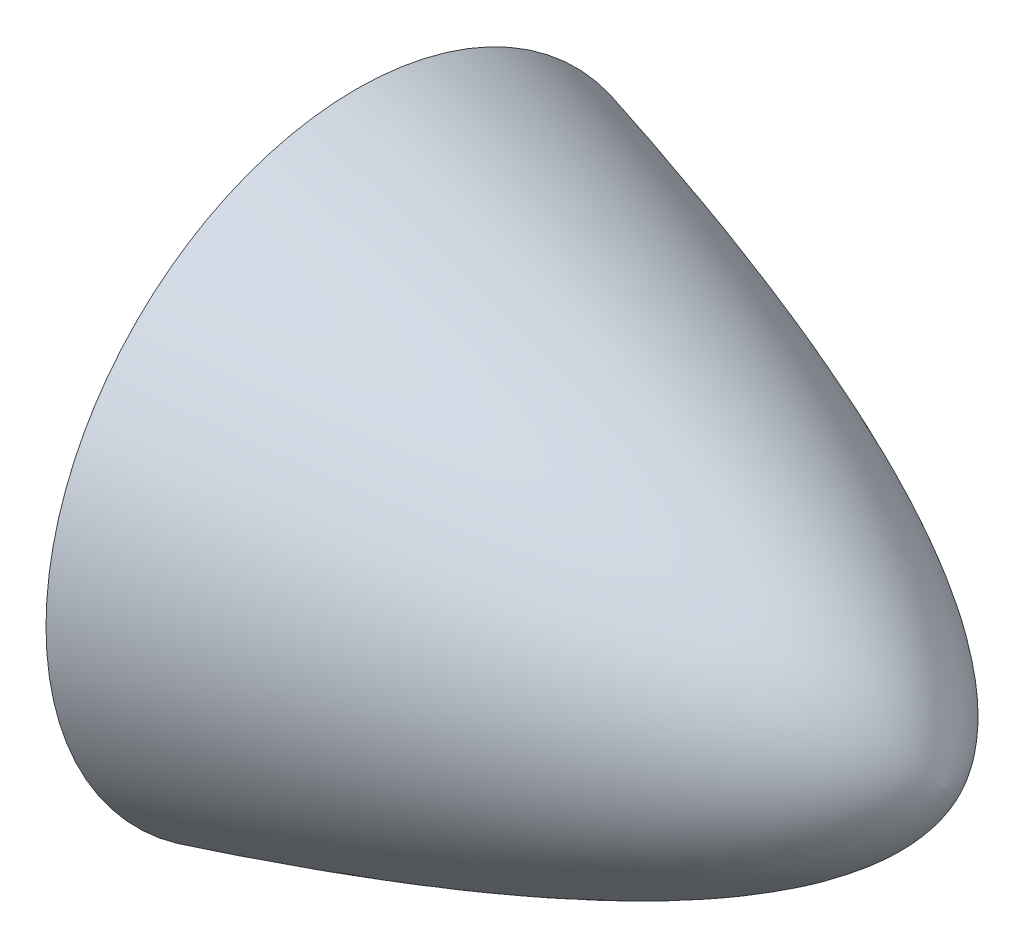
from build123d import *


with BuildPart() as part:
    # Sketch1 → Revolve1 (revolve)
    with BuildSketch(Plane.XY):
        with BuildLine():
            Line((0, 0), (0, 19.05))
            add(Edge.make_bspline(
                [(0, 19.05), (34.508798701, 9.841293132), (36.168463011, 0)],
                knots=[0, 0, 0, 1, 1, 1], degree=2))
            Line((36.168463011, 0), (0, 0))
        make_face()
    revolve(axis=Axis((0, 0, 0), (1, 0, 0)))


solid = part.part
